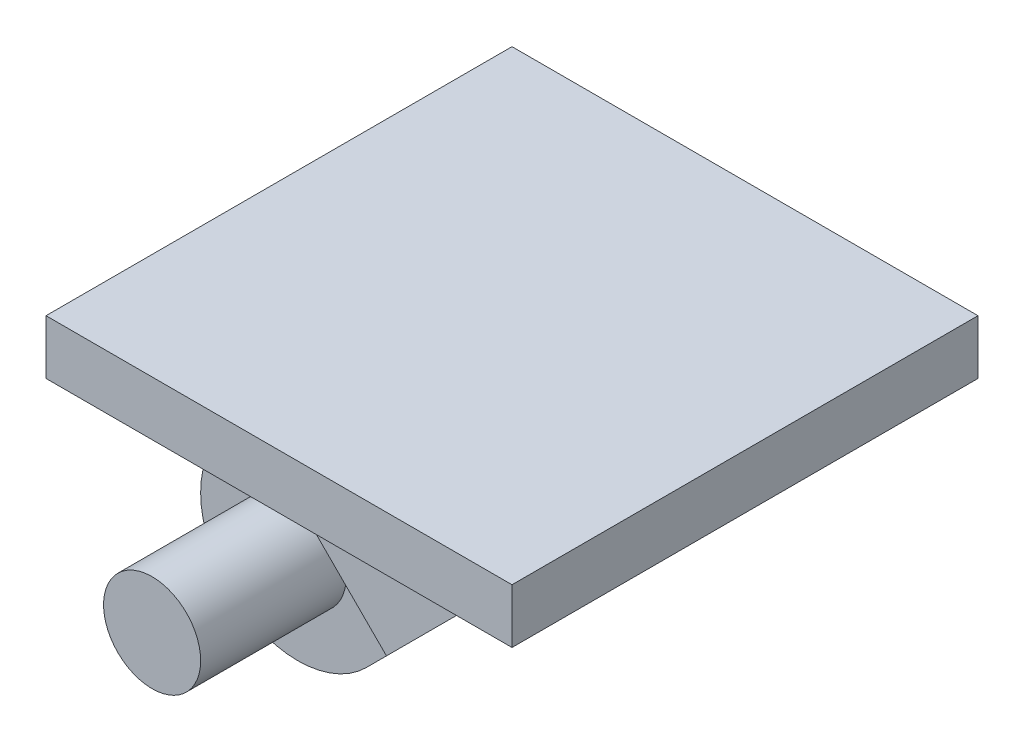
from build123d import *

# Parameters (mm, degrees)
SKETCH_1_W           = 60
SKETCH_1_H           = 60
EXTRUDE_1_DEPTH      = 7
EXTRUDE_2_DEPTH      = 12.5
EXTRUDE_2_DEPTH_BACK = 12.5
CUT_EXTRUDE_START    = -12.5
CUT_EXTRUDE_1_DEPTH  = 6.25
CUT_EXTRUDE_START_2  = 6.25
CUT_EXTRUDE_2_DEPTH  = 6.25
EXTRUDE_3_DEPTH      = 25
EXTRUDE_3_DEPTH_BACK = 25
SKETCH_5_R           = 6.25


with BuildPart() as part:
    # 草图1 → 凸台-拉伸1 (new body)
    with BuildSketch(Plane(origin=(0, 0, 0), x_dir=(1, 0, 0), z_dir=(0, 1, 0))):
        Rectangle(SKETCH_1_W, SKETCH_1_H)
    extrude(amount=EXTRUDE_1_DEPTH)

    # 草图2 → 凸台-拉伸2 (add, two sides: drawn at the far end of the back side and taken through both)
    with BuildSketch(Plane.XY.offset(-EXTRUDE_2_DEPTH_BACK)):
        with BuildLine():
            Line((-12.5, 0), (12.5, 0))
            ThreePointArc((12.5, 0), (10.596988313, -9.567085809), (5.17766953, -17.67766953))
            Line((5.17766953, -17.67766953), (-12.5, -35.355339059))
            ThreePointArc((-12.5, -35.355339059), (-30.17766953, -35.355339059), (-30.17766953, -17.67766953))
            Line((-30.17766953, -17.67766953), (-12.5, 0))
        make_face()
    extrude(amount=EXTRUDE_2_DEPTH + EXTRUDE_2_DEPTH_BACK)

    # 草图3 → 切除-拉伸1 (cut)
    with BuildSketch(Plane.XY.offset(CUT_EXTRUDE_START)):
        with BuildLine():
            Line((-21.338834765, -8.838834765), (-3.661165235, -26.516504294))
            Line((-3.661165235, -26.516504294), (-12.5, -35.355339059))
            ThreePointArc((-12.5, -35.355339059), (-30.17766953, -35.355339059), (-30.17766953, -17.67766953))
            Line((-30.17766953, -17.67766953), (-21.338834765, -8.838834765))
        make_face()
    extrude(amount=CUT_EXTRUDE_1_DEPTH, mode=Mode.SUBTRACT)

    # 草图4 → 切除-拉伸2 (cut)
    with BuildSketch(Plane.XY.offset(CUT_EXTRUDE_START_2)):
        with BuildLine():
            Line((-3.661165235, -26.516504294), (-21.338834765, -8.838834765))
            Line((-21.338834765, -8.838834765), (-30.17766953, -17.67766953))
            ThreePointArc((-30.17766953, -17.67766953), (-30.17766953, -35.355339059), (-12.5, -35.355339059))
            Line((-12.5, -35.355339059), (-3.661165235, -26.516504294))
        make_face()
    extrude(amount=CUT_EXTRUDE_2_DEPTH, mode=Mode.SUBTRACT)

    # 草图5 → 凸台-拉伸3 (add, two sides: drawn at the far end of the back side and taken through both)
    with BuildSketch(Plane.XY.offset(-EXTRUDE_3_DEPTH_BACK)):
        with Locations((-21.338834765, -26.516504294)):
            Circle(SKETCH_5_R)
    extrude(amount=EXTRUDE_3_DEPTH + EXTRUDE_3_DEPTH_BACK)


solid = part.part
